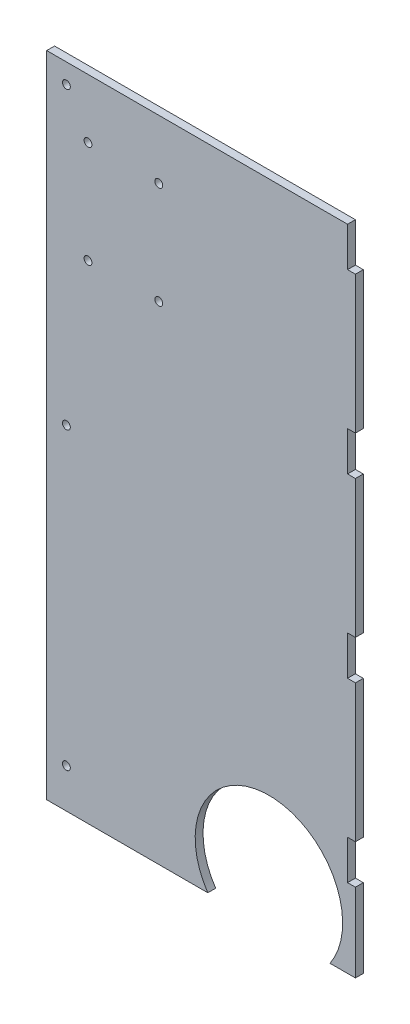
from build123d import *

# Parameters (mm, degrees)
SKETCH1_W           = 165
SKETCH1_H           = 330
BOSS_EXTRUDE1_DEPTH = 4
SKETCH2_R           = 37.5
CUT_EXTRUDE1_DEPTH  = 202.285866369
SKETCH4_W           = 8
SKETCH4_H           = 300
CUT_EXTRUDE3_DEPTH  = 202.285866369
SKETCH3_W           = 4
SKETCH3_H           = 20
CUT_EXTRUDE2_DEPTH  = 202.285866369
SKETCH5_W           = 8
SKETCH5_H           = 30
CUT_EXTRUDE4_DEPTH  = 202.285866369
SKETCH6_R           = 2
CUT_EXTRUDE5_DEPTH  = 198.838317825
SKETCH7_R           = 2
CUT_EXTRUDE6_DEPTH  = 198.838317825


with BuildPart() as part:
    # Sketch1 → Boss-Extrude1 (new body)
    with BuildSketch(Plane.XY):
        with Locations((7.5, -15)):
            Rectangle(SKETCH1_W, SKETCH1_H)
    extrude(amount=BOSS_EXTRUDE1_DEPTH)

    # Sketch2 → Cut-Extrude1 (cut, through all)
    with BuildSketch(Plane.XY.offset(4)):
        with Locations((38, -159)):
            Circle(SKETCH2_R)
    extrude(amount=-CUT_EXTRUDE1_DEPTH, mode=Mode.SUBTRACT)

    # Sketch4 → Cut-Extrude3 (cut, through all)
    with BuildSketch(Plane(origin=(0, 0, 0), x_dir=(-1, 0, 0), z_dir=(0, 0, -1))):
        with Locations((-86, 0)):
            Rectangle(SKETCH4_W, SKETCH4_H)
    extrude(amount=-CUT_EXTRUDE3_DEPTH, mode=Mode.SUBTRACT)

    # Sketch3 → Cut-Extrude2 (cut, through all)
    with BuildSketch(Plane(origin=(0, 0, 0), x_dir=(-1, 0, 0), z_dir=(0, 0, -1))):
        with Locations((-80, 140)):
            Rectangle(SKETCH3_W, SKETCH3_H)
        with Locations((-80, 50)):
            Rectangle(SKETCH3_W, SKETCH3_H)
        with Locations((-80, -40)):
            Rectangle(SKETCH3_W, SKETCH3_H)
        with Locations((-80, -130)):
            Rectangle(SKETCH3_W, SKETCH3_H)
    extrude(amount=-CUT_EXTRUDE2_DEPTH, mode=Mode.SUBTRACT)

    # Sketch5 → Cut-Extrude4 (cut, through all)
    with BuildSketch(Plane.XY.offset(4)):
        with Locations((86, -165)):
            Rectangle(SKETCH5_W, SKETCH5_H)
    extrude(amount=-CUT_EXTRUDE4_DEPTH, mode=Mode.SUBTRACT)

    # Sketch6 → Cut-Extrude5 (cut, through all)
    with BuildSketch(Plane(origin=(0, 0, 0), x_dir=(-1, 0, 0), z_dir=(0, 0, -1))):
        with Locations((18, 120)):
            Circle(SKETCH6_R)
        with Locations((54, 120)):
            Circle(SKETCH6_R)
        with Locations((18, 68)):
            Circle(SKETCH6_R)
        with Locations((54, 68)):
            Circle(SKETCH6_R)
    extrude(amount=-CUT_EXTRUDE5_DEPTH, mode=Mode.SUBTRACT)

    # Sketch7 → Cut-Extrude6 (cut, through all)
    with BuildSketch(Plane.XY.offset(4)):
        with Locations((-65, 140)):
            Circle(SKETCH7_R)
        with Locations((-65, -10)):
            Circle(SKETCH7_R)
        with Locations((-65, -160)):
            Circle(SKETCH7_R)
    extrude(amount=-CUT_EXTRUDE6_DEPTH, mode=Mode.SUBTRACT)


solid = part.part
